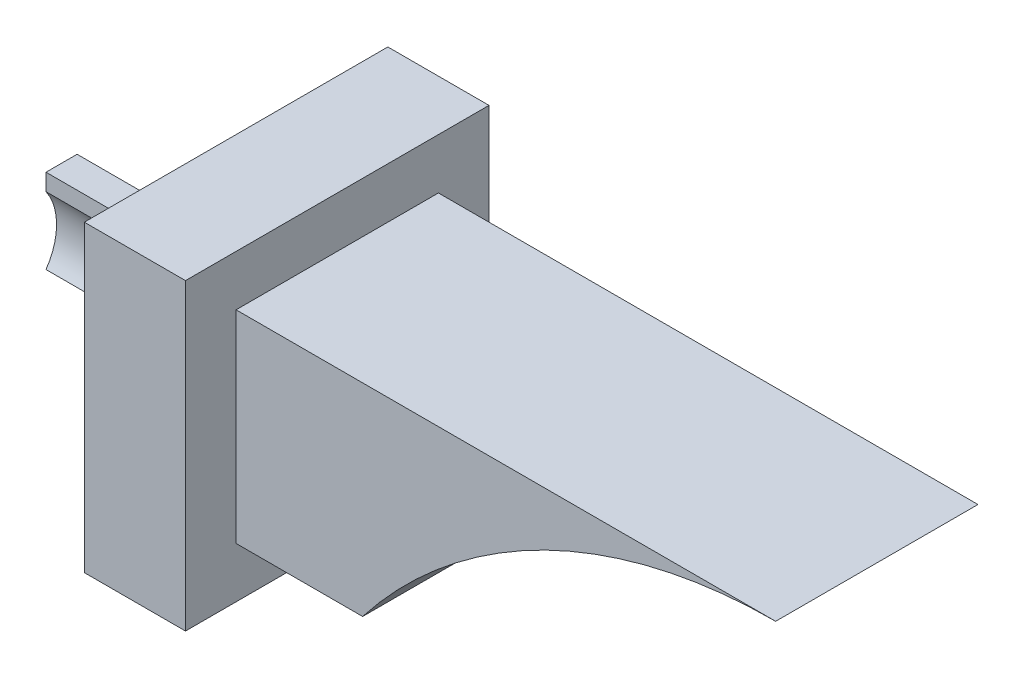
from build123d import *

# Parameters (mm, degrees)
EXTRUDE_1_DEPTH = 12
SKETCH_2_W      = 18
SKETCH_2_H      = 18
EXTRUDE_2_DEPTH = 6
EXTRUDE_3_DEPTH = 10


with BuildPart() as part:
    # 스케치1 → 보스-돌출1 (new body)
    with BuildSketch(Plane.XY):
        with BuildLine():
            Line((15.355510937, 5.870718563), (-16.644489063, 5.870718563))
            Line((-16.644489063, 5.870718563), (-16.644489063, -6.129281437))
            Line((-16.644489063, -6.129281437), (-9.139386491, -6.129281437))
            ThreePointArc((-9.139386491, -6.129281437), (1.71732924, 2.709540377), (15.355510937, 5.870718563))
        make_face()
    extrude(amount=EXTRUDE_1_DEPTH)

    # 스케치2 → 보스-돌출2 (add)
    with BuildSketch(Plane.ZY.offset(16.644489063)):
        with Locations((6, -0.129281437)):
            Rectangle(SKETCH_2_W, SKETCH_2_H)
    extrude(amount=EXTRUDE_2_DEPTH)

    # 스케치3 → 보스-돌출3 (add)
    with BuildSketch(Plane.ZY.offset(22.644489063)):
        with BuildLine():
            Line((5.428283523, 1.573651364), (5.428283523, 2.573651364))
            Line((5.428283523, 2.573651364), (7.272757062, 2.573651364))
            Line((7.272757062, 2.573651364), (7.272757062, 1.573651364))
            ThreePointArc((7.272757062, 1.573651364), (6.645038385, -0.426348636), (7.272757062, -2.426348636))
            Line((7.272757062, -2.426348636), (5.428283523, -2.426348636))
            ThreePointArc((5.428283523, -2.426348636), (6.0560022, -0.426348636), (5.428283523, 1.573651364))
        make_face()
    extrude(amount=EXTRUDE_3_DEPTH)


solid = part.part
